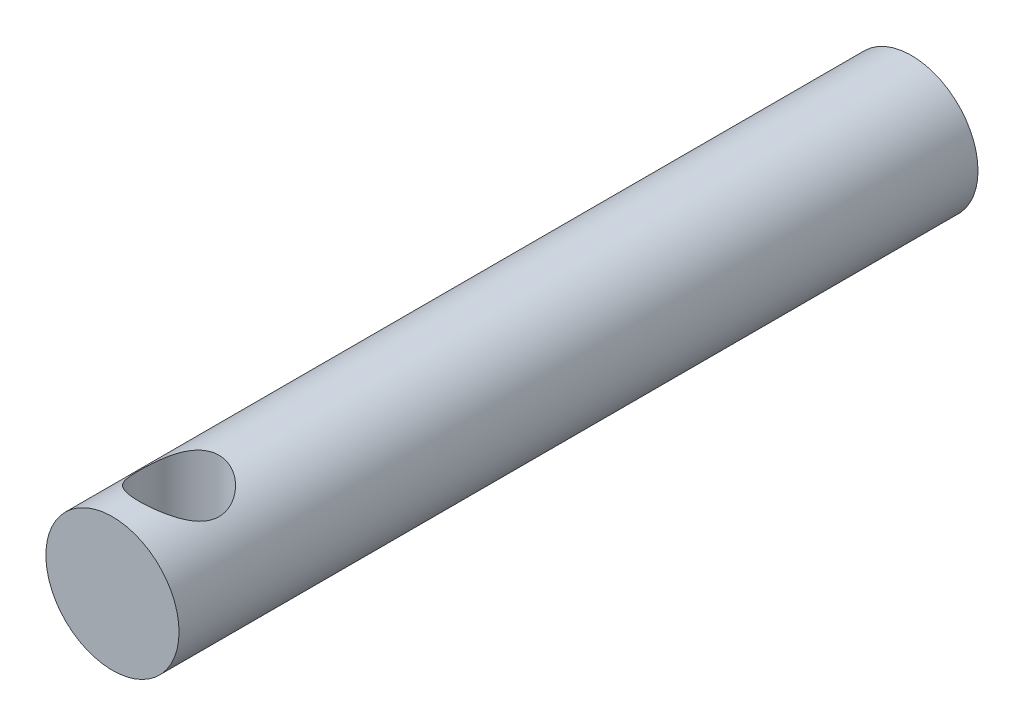
from build123d import *

# Parameters (mm, degrees)
SKETCH1_R               = 2.5
BOSS_EXTRUDE1_DEPTH     = 30
CUT_EXTRUDE1_DEPTH      = 31.207614934
CUT_EXTRUDE1_DEPTH_BACK = 31.207614934
SKETCH2_R               = 1.5


with BuildPart() as part:
    # Sketch1 → Boss-Extrude1 (new body)
    with BuildSketch(Plane.XY):
        Circle(SKETCH1_R)
    extrude(amount=BOSS_EXTRUDE1_DEPTH)

    # Sketch2 → Cut-Extrude1 (cut, two sides: drawn at the far end of the back side and taken through both)
    with BuildSketch(Plane(origin=(0, 0, 0), x_dir=(1, 0, 0), z_dir=(0, 1, 0)).offset(-CUT_EXTRUDE1_DEPTH_BACK)):
        with Locations(Location((0, -27.5, 0), (0, 0, 270))):
            Circle(SKETCH2_R)
    extrude(amount=CUT_EXTRUDE1_DEPTH + CUT_EXTRUDE1_DEPTH_BACK, mode=Mode.SUBTRACT)


solid = part.part
